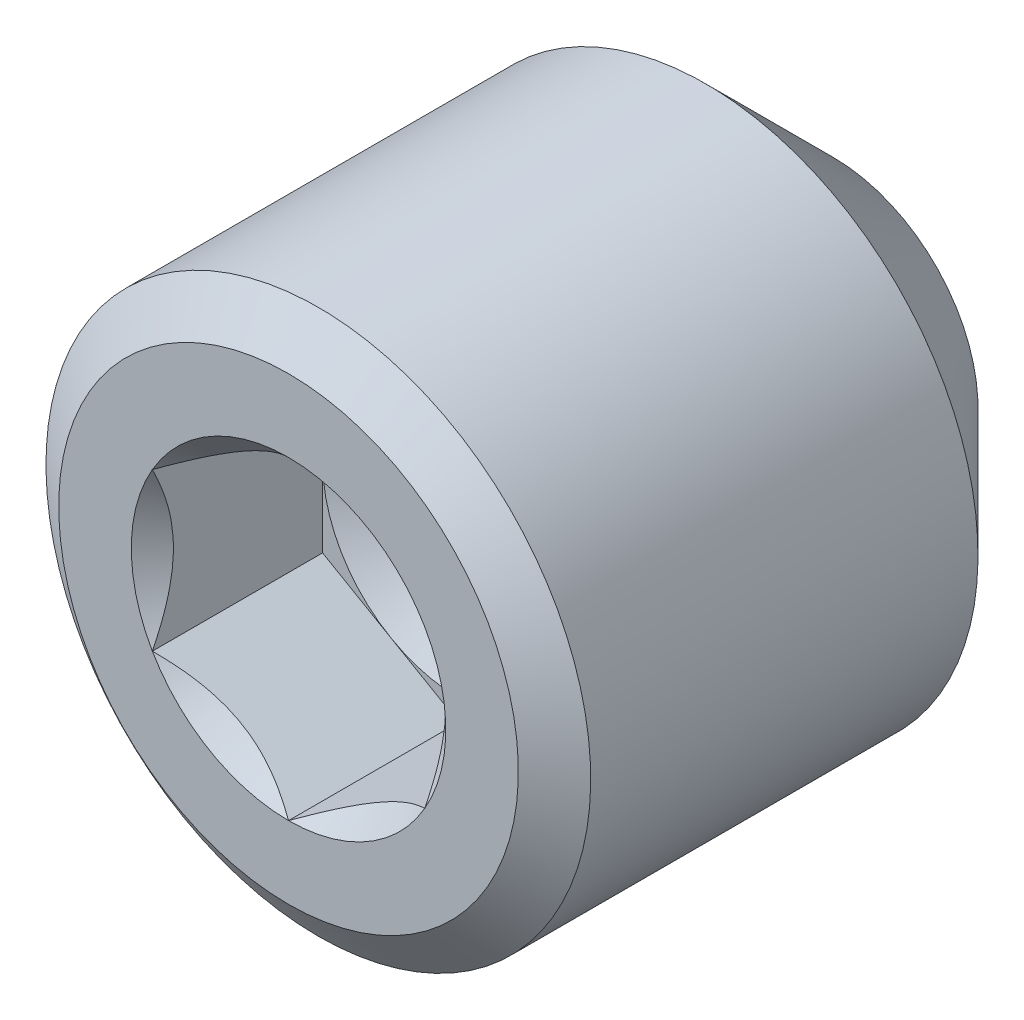
from build123d import *

# Parameters (mm, degrees)
CUT_EXTRUDE1_DEPTH = 2.5


with BuildPart() as part:
    # Sketch11 → Revolve1 (revolve)
    with BuildSketch(Plane(origin=(0, 0, 0), x_dir=(0, 0, -1), z_dir=(1, 0, 0))):
        Polygon((-4, 0), (-4, 3.375), (-3.562370289, 4), (2.125, 4), (4, 2.125), (2.723171185, 0), align=None)
    revolve(axis=Axis((0, 0, -2.723171185), (0, 0, -1)))

    # Sketch2 → Cut-Extrude1 (cut)
    with BuildSketch(Plane.XY.offset(4)):
        Polygon((0, 2.309401077), (-2, 1.154700538), (-2, -1.154700538), (0, -2.309401077), (2, -1.154700538), (2, 1.154700538), align=None)
    extrude(amount=-CUT_EXTRUDE1_DEPTH, mode=Mode.SUBTRACT)

    # Cut-Extrude2 cone 1 section (through the dimple's axis) → Cut-Extrude2 (revolve, cut)
    with BuildSketch(Plane(origin=(0, 0, 4), x_dir=(0, -1, 0), z_dir=(1, 0, 0))):
        Polygon((0, 0), (2.309401077, 0), (0, 2.309401077), align=None)
    revolve(axis=Axis((0, 0, 4), (0, 0, -1)), mode=Mode.SUBTRACT)

    # Cut-Extrude3 cone 1 section (through the dimple's axis) → Cut-Extrude3 (revolve, cut)
    with BuildSketch(Plane(origin=(0, 0, 1.5), x_dir=(0, -1, 0), z_dir=(1, 0, 0))):
        Polygon((0, 0), (2, 0), (0, 1.154700538), align=None)
    revolve(axis=Axis((0, 0, 1.5), (0, 0, -1)), mode=Mode.SUBTRACT)


solid = part.part
